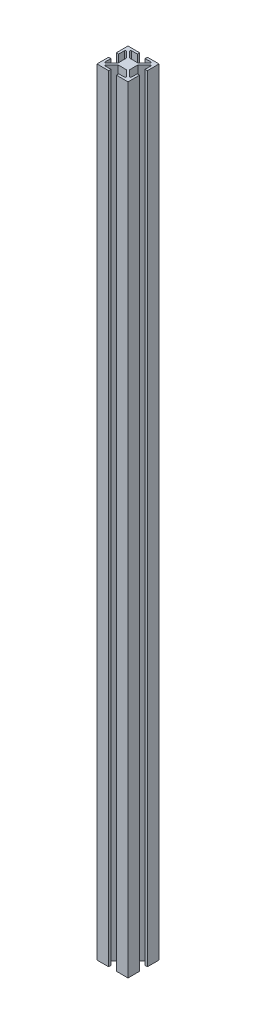
from build123d import *

# Parameters (mm, degrees)
BOSS_EXTRU_1_DEPTH = 500


with BuildPart() as part:
    # Esquisse1 → Boss.-Extru.1 (new body)
    with BuildSketch(Plane(origin=(0, 0, 0), x_dir=(1, 0, 0), z_dir=(0, 1, 0))):
        with BuildLine():
            Line((-10, -2.5), (-10, -10))
            Line((-10, -10), (-2.5, -10))
            Line((-2.5, -10), (-2.5, -8.5))
            Line((-2.5, -8.5), (-6.232233047, -8.5))
            ThreePointArc((-6.232233047, -8.5), (-6.694172813, -8.191341716), (-6.585786438, -7.646446609))
            Line((-6.585786438, -7.646446609), (-2.689339828, -3.75))
            Line((-2.689339828, -3.75), (2.689339828, -3.75))
            Line((2.689339828, -3.75), (6.585786438, -7.646446609))
            ThreePointArc((6.585786438, -7.646446609), (6.694172813, -8.191341716), (6.232233047, -8.5))
            Line((6.232233047, -8.5), (2.5, -8.5))
            Line((2.5, -8.5), (2.5, -10))
            Line((2.5, -10), (10, -10))
            Line((10, -10), (10, -2.5))
            Line((10, -2.5), (8.5, -2.5))
            Line((8.5, -2.5), (8.5, -6.232233047))
            ThreePointArc((8.5, -6.232233047), (8.191341716, -6.694172813), (7.646446609, -6.585786438))
            Line((7.646446609, -6.585786438), (3.75, -2.689339828))
            Line((3.75, -2.689339828), (3.75, 2.689339828))
            Line((3.75, 2.689339828), (7.646446609, 6.585786438))
            ThreePointArc((7.646446609, 6.585786438), (8.191341716, 6.694172813), (8.5, 6.232233047))
            Line((8.5, 6.232233047), (8.5, 2.5))
            Line((8.5, 2.5), (10, 2.5))
            Line((10, 2.5), (10, 10))
            Line((10, 10), (2.5, 10))
            Line((2.5, 10), (2.5, 8.5))
            Line((2.5, 8.5), (6.232233047, 8.5))
            ThreePointArc((6.232233047, 8.5), (6.694172813, 8.191341716), (6.585786438, 7.646446609))
            Line((6.585786438, 7.646446609), (2.689339828, 3.75))
            Line((2.689339828, 3.75), (-2.689339828, 3.75))
            Line((-2.689339828, 3.75), (-6.585786438, 7.646446609))
            ThreePointArc((-6.585786438, 7.646446609), (-6.694172813, 8.191341716), (-6.232233047, 8.5))
            Line((-6.232233047, 8.5), (-2.5, 8.5))
            Line((-2.5, 8.5), (-2.5, 10))
            Line((-2.5, 10), (-10, 10))
            Line((-10, 10), (-10, 2.5))
            Line((-10, 2.5), (-8.5, 2.5))
            Line((-8.5, 2.5), (-8.5, 6.232233047))
            ThreePointArc((-8.5, 6.232233047), (-8.191341716, 6.694172813), (-7.646446609, 6.585786438))
            Line((-7.646446609, 6.585786438), (-3.75, 2.689339828))
            Line((-3.75, 2.689339828), (-3.75, -2.689339828))
            Line((-3.75, -2.689339828), (-7.646446609, -6.585786438))
            ThreePointArc((-7.646446609, -6.585786438), (-8.191341716, -6.694172813), (-8.5, -6.232233047))
            Line((-8.5, -6.232233047), (-8.5, -2.5))
            Line((-8.5, -2.5), (-10, -2.5))
        make_face()
    extrude(amount=BOSS_EXTRU_1_DEPTH)


solid = part.part
